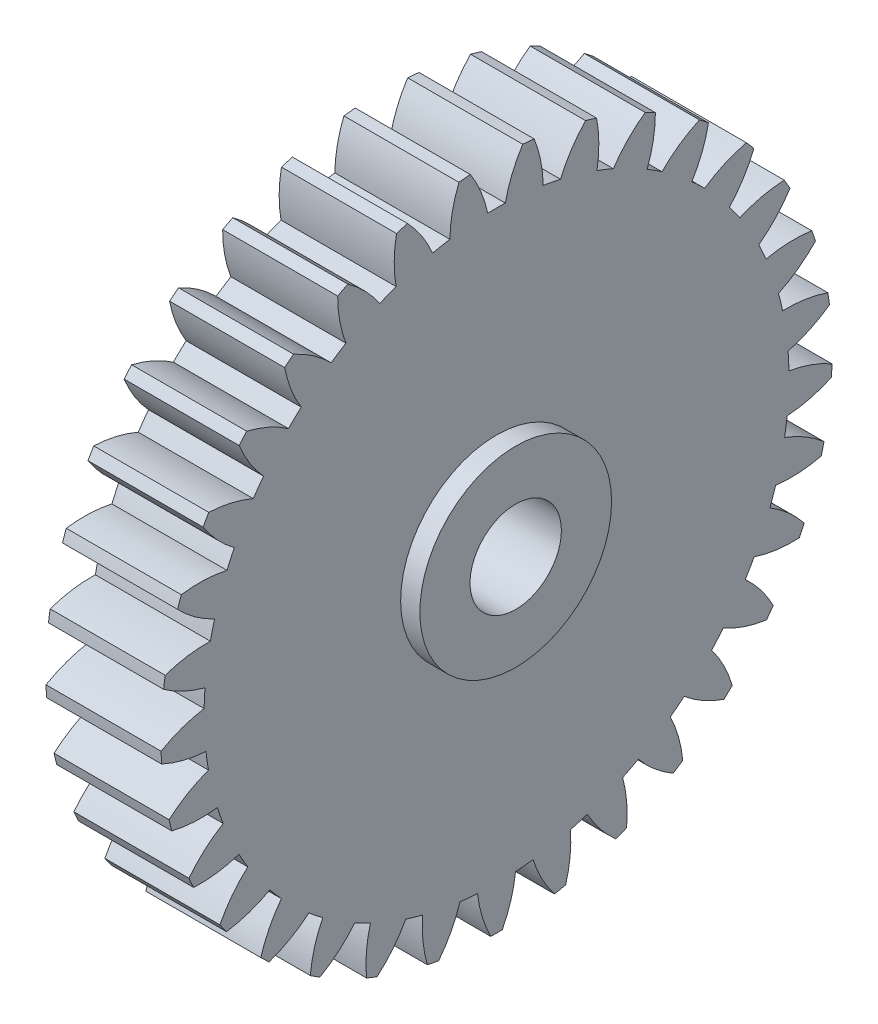
from build123d import *

# Parameters (mm, degrees)
BASPROSKE_W                  = 6
BASPROSKE_H                  = 17.5
TOOTHCUT_DEPTH               = 26.465663156
TEETHCUTS_COUNT              = 33
TEETHCUTS_ANGLE              = 349.090909091
BORSKE_R                     = 5
BORE_DEPTH                   = 50.0000508
SALIENTE_EXTRUIR2_DEPTH      = 1
SALIENTE_EXTRUIR2_DEPTH_BACK = 6
CROQUIS1_R                   = 5
CROQUIS1_R_2                 = 2.38125


with BuildPart() as part:
    # BasProSke → Base-Revolve (revolve)
    with BuildSketch(Plane(origin=(0, 0, 0), x_dir=(1, 0, 0), z_dir=(0, 1, 0)), mode=Mode.PRIVATE) as base_revolve_sk:
        with Locations((3, 8.75)):
            Rectangle(BASPROSKE_W, BASPROSKE_H)
    revolve(base_revolve_sk.sketch.rotate(Axis((-10, 0, 0), (1, 0, 0)), 180), axis=Axis((-10, 0, 0), (1, 0, 0)))

    # TooCutSke → ToothCut (cut, through all)
    with BuildSketch(Plane(origin=(0, 0, 0), x_dir=(0, 0, -1), z_dir=(1, 0, 0))):
        with BuildLine():
            ThreePointArc((0.460038855, 15.242059088), (0, 15.249), (-0.460038855, 15.242059088))
            ThreePointArc((-0.460038855, 15.242059088), (-0.818271128, 16.398913356), (-1.381851371, 17.470836613))
            ThreePointArc((-1.381851371, 17.470836613), (0, 17.5254), (1.381851371, 17.470836613))
            ThreePointArc((1.381851371, 17.470836613), (0.818271128, 16.398913356), (0.460038855, 15.242059088))
        make_face()
    toothcut = extrude(amount=TOOTHCUT_DEPTH, mode=Mode.SUBTRACT)

    # TeethCuts: ToothCut ×33 about axis
    teethcuts_axis = Axis((-10, 0, 0), (1, 0, 0))
    for i in range(1, TEETHCUTS_COUNT):
        add(toothcut.rotate(teethcuts_axis, i * TEETHCUTS_ANGLE / (TEETHCUTS_COUNT - 1)), mode=Mode.SUBTRACT)

    # BorSke → Bore (cut, symmetric)
    with BuildSketch(Plane(origin=(0, 0, 0), x_dir=(0, 0, -1), z_dir=(1, 0, 0))):
        with Locations(Location((0, 0, 0), (0, 0, 180))):
            Circle(BORSKE_R)
    extrude(amount=BORE_DEPTH, both=True, mode=Mode.SUBTRACT)

    # Croquis1 → Saliente-Extruir2 (add, two sides: drawn at the far end of the back side and taken through both)
    with BuildSketch(Plane(origin=(6, 0, 0), x_dir=(0, 0, -1), z_dir=(1, 0, 0)).offset(-SALIENTE_EXTRUIR2_DEPTH_BACK)):
        Circle(CROQUIS1_R)
        Circle(CROQUIS1_R_2, mode=Mode.SUBTRACT)
    extrude(amount=SALIENTE_EXTRUIR2_DEPTH + SALIENTE_EXTRUIR2_DEPTH_BACK)


solid = part.part
